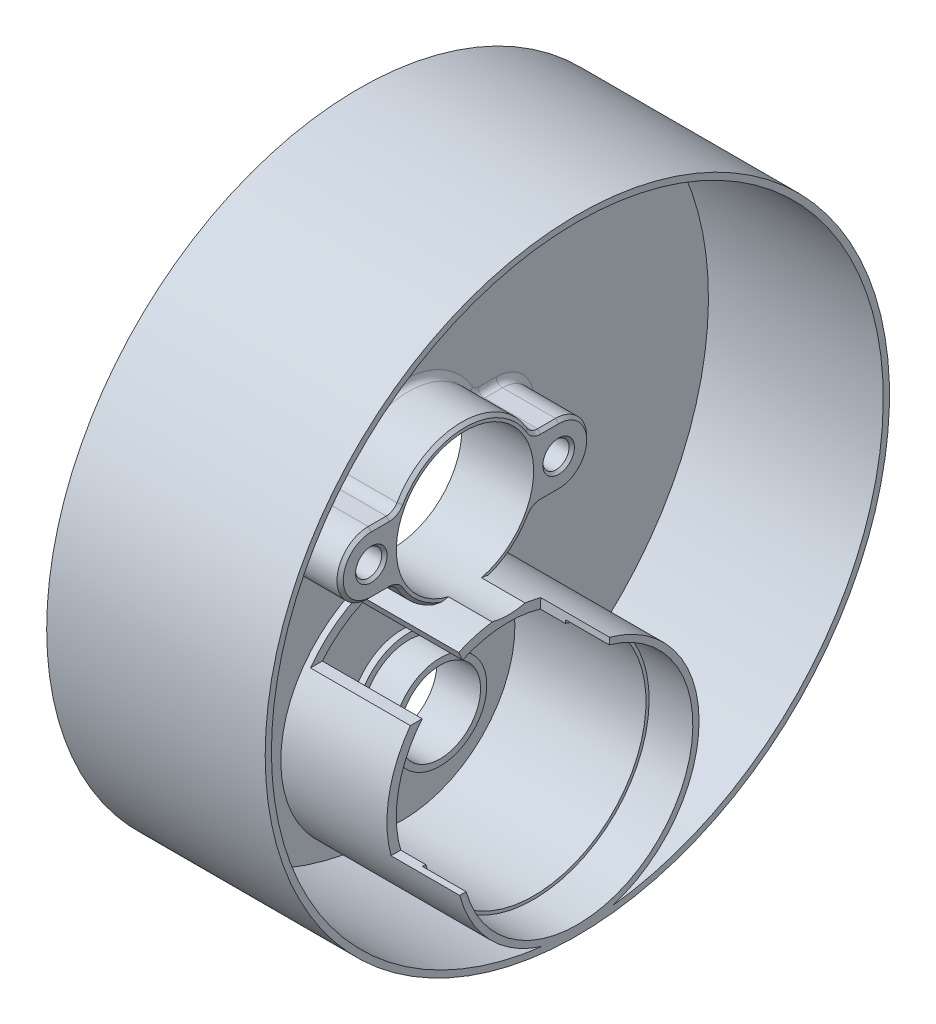
from build123d import *

# Parameters (mm, degrees)
CUT_EXTRUDE_START        = -11
CUT_EXTRUDE_1_DEPTH      = 11
CUT_EXTRUDE_2_DEPTH      = 27
EXTRUDE_START            = -1
SKETCH_4_R               = 50
SKETCH_4_R_2             = 6.5
EXTRUDE_1_DEPTH          = 1
EXTRUDE_2_DEPTH          = 6
EXTRUDE_2_DEPTH_BACK     = 29
SKETCH_5_R               = 50
SKETCH_5_R_2             = 49
EXTRUDE_3_DEPTH          = 1.5
EXTRUDE_3_DEPTH_BACK     = 10
SKETCH_15_R              = 12
SKETCH_15_R_2            = 11
EXTRUDE_4_DEPTH          = 10
M5X0_81_D                = 4.2
M5X0_81_CSINK_D          = 5.05
M5X0_81_CSINK_ANGLE      = 90
FILLET_1_R               = 2
FILLET_1_OF_MIRROR_1_R   = 2
FILLET_2_R               = 1
CHAMFER_1_SIZE           = 0.5
CUT_EXTRUDE_4_DEPTH      = 99.40731683
CUT_EXTRUDE_4_DEPTH_BACK = 99.40731683
SKETCH_16_R              = 11
CUT_EXTRUDE_3_REACH      = 100.697
SKETCH_12_R              = 5
M2X0_41_D                = 1.6
PATTERN_CIRCULAR_1_COUNT = 3


with BuildPart() as part:
    # Эскиз1 → Повернуть1 (revolve)
    with BuildSketch(Plane.XY, mode=Mode.PRIVATE) as revolve_1_sk:
        Polygon((-27, 7.5), (-27, 8.5), (-28, 8.5), (-28, 18), (-7, 18), (-7, 18.5), (0, 18.5), (0, 19.5), (-29, 19.5), (-29, 6.5), (-22, 6.5), (-22, 7.5), align=None)
    revolve(revolve_1_sk.sketch.rotate(Axis((0, 0, 0), (1, 0, 0)), 90), axis=Axis((0, 0, 0), (1, 0, 0)))

    # Эскиз2 → Вырез-Вытянуть1 (cut)
    with BuildSketch(Plane(origin=(0, 0, 0), x_dir=(0, 0, -1), z_dir=(1, 0, 0)).offset(CUT_EXTRUDE_START)):
        with BuildLine():
            Line((5.156251293, 18.805931846), (5, 16.248076809))
            ThreePointArc((5, 16.248076809), (-12.02081528, 12.02081528), (-16.248076809, -5))
            Line((-16.248076809, -5), (-18.848076825, -5))
            ThreePointArc((-18.848076825, -5), (-13.731246096, 13.845680938), (5.156251293, 18.805931846))
        make_face()
    extrude(amount=CUT_EXTRUDE_1_DEPTH, mode=Mode.SUBTRACT)

    # Эскиз3 → Вырез-Вытянуть2 (cut)
    with BuildSketch(Plane(origin=(0, 0, 0), x_dir=(0, 0, -1), z_dir=(1, 0, 0))):
        with BuildLine():
            Line((-40, 11.5), (-12.519984026, 11.5))
            ThreePointArc((-12.519984026, 11.5), (-9.954045186, 13.781037132), (-6.982120022, 15.5))
            Line((-6.982120022, 15.5), (-13.240816858, 29.394032278))
            Line((-13.240816858, 29.394032278), (-40, 11.5))
        make_face()
    extrude(amount=-CUT_EXTRUDE_2_DEPTH, mode=Mode.SUBTRACT)

    # Эскиз4 → Бобышка-Вытянуть1 (add)
    with BuildSketch(Plane.ZY.offset(29).offset(EXTRUDE_START)):
        with Locations((0, 30)):
            Circle(SKETCH_4_R)
        Circle(SKETCH_4_R_2, mode=Mode.SUBTRACT)
    extrude(amount=EXTRUDE_1_DEPTH)

    # Эскиз5 → Бобышка-Вытянуть2 (add, two sides: drawn at the far end of the back side and taken through both)
    with BuildSketch(Plane.ZY.offset(29).offset(-EXTRUDE_2_DEPTH_BACK)):
        with Locations((0, 30)):
            Circle(SKETCH_5_R)
        with Locations(Location((0, 30, 0), (0, 0, 180))):
            Circle(SKETCH_5_R_2, mode=Mode.SUBTRACT)
    extrude(amount=EXTRUDE_2_DEPTH + EXTRUDE_2_DEPTH_BACK)

    # Эскиз15 → Бобышка-Вытянуть3 (add, two sides: drawn at the far end of the back side and taken through both)
    with BuildSketch(Plane.ZY.offset(28).offset(-EXTRUDE_3_DEPTH_BACK)):
        with Locations(Location((0, 30, 0), (0, 0, 180))):
            Circle(SKETCH_15_R)
        with Locations(Location((0, 30, 0), (0, 0, 180))):
            Circle(SKETCH_15_R_2, mode=Mode.SUBTRACT)
    extrude(amount=EXTRUDE_3_DEPTH + EXTRUDE_3_DEPTH_BACK)

    # Эскиз17 → Бобышка-Вытянуть4 (add)
    with BuildSketch(Plane(origin=(-28, 0, 0), x_dir=(0, 0, -1), z_dir=(1, 0, 0))):
        with BuildLine():
            Line((-15, 35), (-10.908712115, 35))
            ThreePointArc((-10.908712115, 35), (-12, 30), (-10.908712115, 25))
            Line((-10.908712115, 25), (-15, 25))
            ThreePointArc((-15, 25), (-20, 30), (-15, 35))
        make_face()
    extrude_4 = extrude(amount=EXTRUDE_4_DEPTH)

    # Отверстие обработанное метчиком M5x0.81 (through all)
    with Locations(Plane(origin=(-18, 0, 0), x_dir=(0, 0, -1), z_dir=(1, 0, 0))):
        with Locations((-15, 30)):
            m5x0_81 = CounterSinkHole(M5X0_81_D / 2, M5X0_81_CSINK_D / 2, counter_sink_angle=M5X0_81_CSINK_ANGLE)

    # Скругление1
    fillet_1_edges = [part.edges().sort_by_distance(p)[0] for p in [
        (-23, 25, 10.908712115),
        (-23, 35, 10.908712115),
    ]]
    fillet(fillet_1_edges, radius=FILLET_1_R)

    # Зеркальное отражение1: Бобышка-Вытянуть4, Отверстие обработанное метчиком M5x0.81 across plane
    add(extrude_4.mirror(Plane.XY))
    add(m5x0_81.mirror(Plane.XY), mode=Mode.SUBTRACT)

    # Скругление1 of Зеркальное отражение1
    fillet_1_of_mirror_1_edges = [part.edges().sort_by_distance(p)[0] for p in [
        (-23, 25, -10.908712115),
        (-23, 35, -10.908712115),
    ]]
    fillet(fillet_1_of_mirror_1_edges, radius=FILLET_1_OF_MIRROR_1_R)

    # Скругление2
    fillet_2_edges = [part.edges().sort_by_distance(p)[0] for p in [
        (-28, 20.998545842, -7.935604769),
        (-28, 30, 20),
        (-28, 25, 13.562177826),
        (-28, 20.998545842, 7.935604769),
        (-28, 35, 13.562177826),
        (-28, 35.267949192, 11.124355653),
        (-28, 24.732050808, 11.124355653),
        (-28, 30, -20),
        (-28, 25, -13.562177826),
        (-28, 42, 0),
        (-28, 35, -13.562177826),
        (-28, 35.267949192, -11.124355653),
        (-28, 24.732050808, -11.124355653),
    ]]
    fillet(fillet_2_edges, radius=FILLET_2_R)

    # Фаска1
    chamfer_1_edges = [part.edges().sort_by_distance(p)[0] for p in [
        (-18, 20.998545842, 7.935604769),
        (-18, 30, 20),
        (-18, 25, 13.562177826),
        (-18, 35, 13.562177826),
        (-18, 42, 0),
        (-18, 24.732050808, 11.124355653),
        (-18, 35.267949192, 11.124355653),
        (-18, 30, -20),
        (-18, 25, -13.562177826),
        (-18, 20.998545842, -7.935604769),
        (-18, 35, -13.562177826),
        (-18, 24.732050808, -11.124355653),
        (-18, 35.267949192, -11.124355653),
    ]]
    chamfer(chamfer_1_edges, length=CHAMFER_1_SIZE)

    # Эскиз16 → Вырез-Вытянуть4 (cut, two sides: drawn at the far end of the back side and taken through both)
    with BuildSketch(Plane(origin=(-28, 0, 0), x_dir=(0, 0, -1), z_dir=(1, 0, 0)).offset(-CUT_EXTRUDE_4_DEPTH_BACK)):
        with Locations(Location((0, 30, 0), (0, 0, 283.872102735))):
            Circle(SKETCH_16_R)
    extrude(amount=CUT_EXTRUDE_4_DEPTH + CUT_EXTRUDE_4_DEPTH_BACK, mode=Mode.SUBTRACT)

    # Эскиз12 → Вырез-Вытянуть3 (cut, up to next)
    with BuildSketch(Plane.ZY.offset(29), mode=Mode.PRIVATE) as cut_extrude_3_sk1:
        with Locations((0, 56.4)):
            Circle(SKETCH_12_R)
    cut_extrude_3_tool1 = extrude(cut_extrude_3_sk1.sketch, amount=-CUT_EXTRUDE_3_REACH, mode=Mode.PRIVATE) & part.part
    add(cut_extrude_3_tool1.solids().sort_by_distance((-29, 56.4, 0))[0], mode=Mode.SUBTRACT)

    # Сверление под метчик M2x0.41 (through all)
    with Locations(Plane.ZY.offset(29)):
        with Locations((0, 62.9)):
            m2x0_41 = Hole(M2X0_41_D / 2)

    # Круговой массив1: Сверление под метчик M2x0.41 ×3 about axis
    pattern_circular_1_axis = Axis((0, 56.4, 0), (1, 0, 0))
    for i in range(1, PATTERN_CIRCULAR_1_COUNT):
        add(m2x0_41.rotate(pattern_circular_1_axis, i * 360 / PATTERN_CIRCULAR_1_COUNT), mode=Mode.SUBTRACT)


solid = part.part
